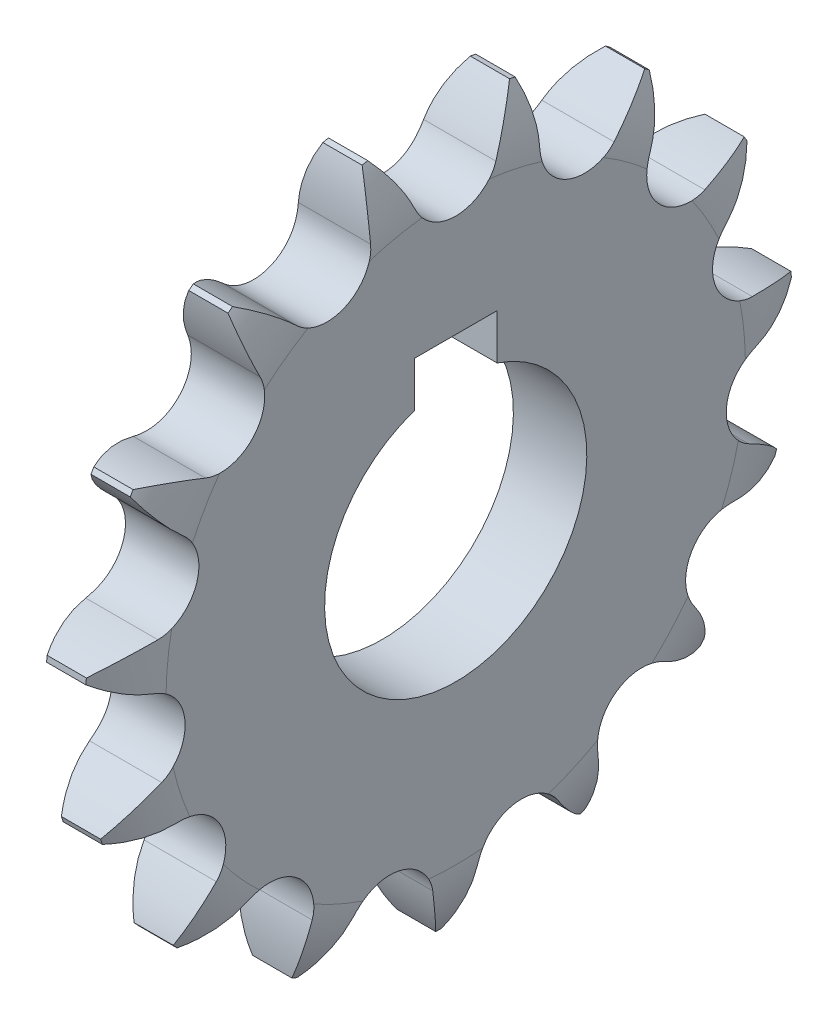
from build123d import *

# Parameters (mm, degrees)
TOOTHCUT_DEPTH  = 37.710811315
TEETHCUTS_COUNT = 15
TEETHCUTS_ANGLE = 336
BORSKE_R        = 9.5
BORE_DEPTH      = 50.0005
KEYSKE_W        = 6
KEYSKE_H        = 12.3
KEYWAY_DEPTH    = 50.0005


with BuildPart() as part:
    # BasProSke → Base-Revolve (revolve)
    with BuildSketch(Plane(origin=(0, 0, 0), x_dir=(1, 0, 0), z_dir=(0, 1, 0)), mode=Mode.PRIVATE) as base_revolve_sk:
        with BuildLine():
            Line((0, 0), (0, 20.988608354))
            ThreePointArc((0, 20.988608354), (0.314698702, 23.416771239), (1.238, 25.684484843))
            Line((1.238, 25.684484843), (4.0816, 25.684484843))
            ThreePointArc((4.0816, 25.684484843), (5.004901298, 23.416771239), (5.3196, 20.988608354))
            Line((5.3196, 20.988608354), (5.3196, 0))
            Line((5.3196, 0), (0, 0))
        make_face()
    revolve(base_revolve_sk.sketch.rotate(Axis((-10, 0, 0), (1, 0, 0)), 180), axis=Axis((-10, 0, 0), (1, 0, 0)))

    # TooCutSke → ToothCut (cut, through all)
    with BuildSketch(Plane(origin=(0, 0, 0), x_dir=(0, 0, -1), z_dir=(1, 0, 0))):
        with BuildLine():
            ThreePointArc((2.951828939, 21.685132796), (4.063020217, 23.756940993), (5.530366998, 25.593793922))
            ThreePointArc((5.530366998, 25.593793922), (0, 26.184484843), (-5.530366998, 25.593793922))
            ThreePointArc((-5.530366998, 25.593793922), (-4.063020217, 23.756940993), (-2.951828939, 21.685132796))
            ThreePointArc((-2.951828939, 21.685132796), (0, 19.731359843), (2.951828939, 21.685132796))
        make_face()
    toothcut = extrude(amount=TOOTHCUT_DEPTH, mode=Mode.SUBTRACT)

    # TeethCuts: ToothCut ×15 about axis
    teethcuts_axis = Axis((-10, 0, 0), (1, 0, 0))
    for i in range(1, TEETHCUTS_COUNT):
        add(toothcut.rotate(teethcuts_axis, i * TEETHCUTS_ANGLE / (TEETHCUTS_COUNT - 1)), mode=Mode.SUBTRACT)

    # BorSke → Bore (cut, symmetric)
    with BuildSketch(Plane(origin=(0, 0, 0), x_dir=(0, 0, -1), z_dir=(1, 0, 0))):
        with Locations(Location((0, 0, 0), (0, 0, 180))):
            Circle(BORSKE_R)
    extrude(amount=BORE_DEPTH, both=True, mode=Mode.SUBTRACT)

    # KeySke → Keyway (cut, symmetric)
    with BuildSketch(Plane(origin=(0, 0, 0), x_dir=(0, 0, -1), z_dir=(1, 0, 0))):
        with Locations((0, 6.15)):
            Rectangle(KEYSKE_W, KEYSKE_H)
    extrude(amount=KEYWAY_DEPTH, both=True, mode=Mode.SUBTRACT)


solid = part.part
